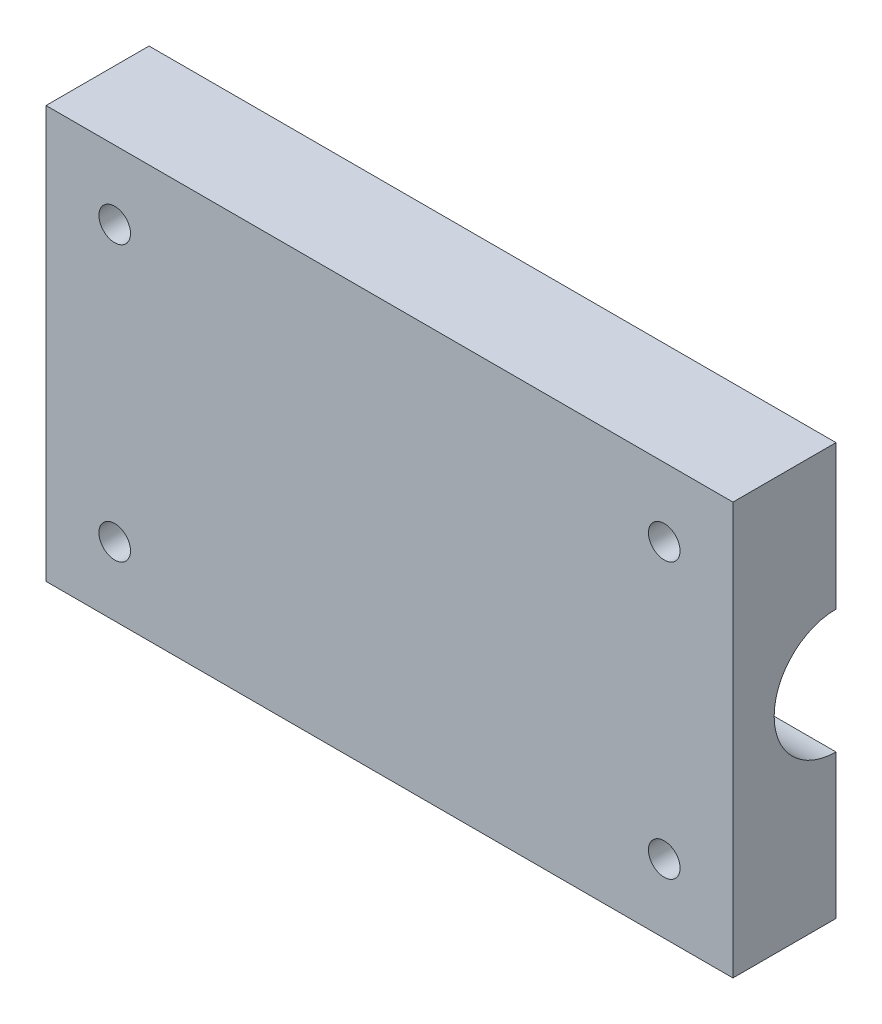
from build123d import *

# Parameters (mm, degrees)
SKETCH1_W           = 100
SKETCH1_H           = 60
SKETCH1_R           = 2.3
BOSS_EXTRUDE1_DEPTH = 15
SKETCH2_R           = 9
CUT_EXTRUDE1_DEPTH  = 200


with BuildPart() as part:
    # Sketch1 → Boss-Extrude1 (new body)
    with BuildSketch(Plane.XY):
        Rectangle(SKETCH1_W, SKETCH1_H)
        with Locations((-40, -20)):
            Circle(SKETCH1_R, mode=Mode.SUBTRACT)
        with Locations(Location((40, -20, 0), (0, 0, 180))):
            Circle(SKETCH1_R, mode=Mode.SUBTRACT)
        with Locations((40, 20)):
            Circle(SKETCH1_R, mode=Mode.SUBTRACT)
        with Locations(Location((-40, 20, 0), (0, 0, 180))):
            Circle(SKETCH1_R, mode=Mode.SUBTRACT)
    extrude(amount=BOSS_EXTRUDE1_DEPTH)

    # Sketch2 → Cut-Extrude1 (cut, symmetric)
    with BuildSketch(Plane.ZY.offset(50)):
        Circle(SKETCH2_R)
    extrude(amount=CUT_EXTRUDE1_DEPTH, both=True, mode=Mode.SUBTRACT)


solid = part.part
